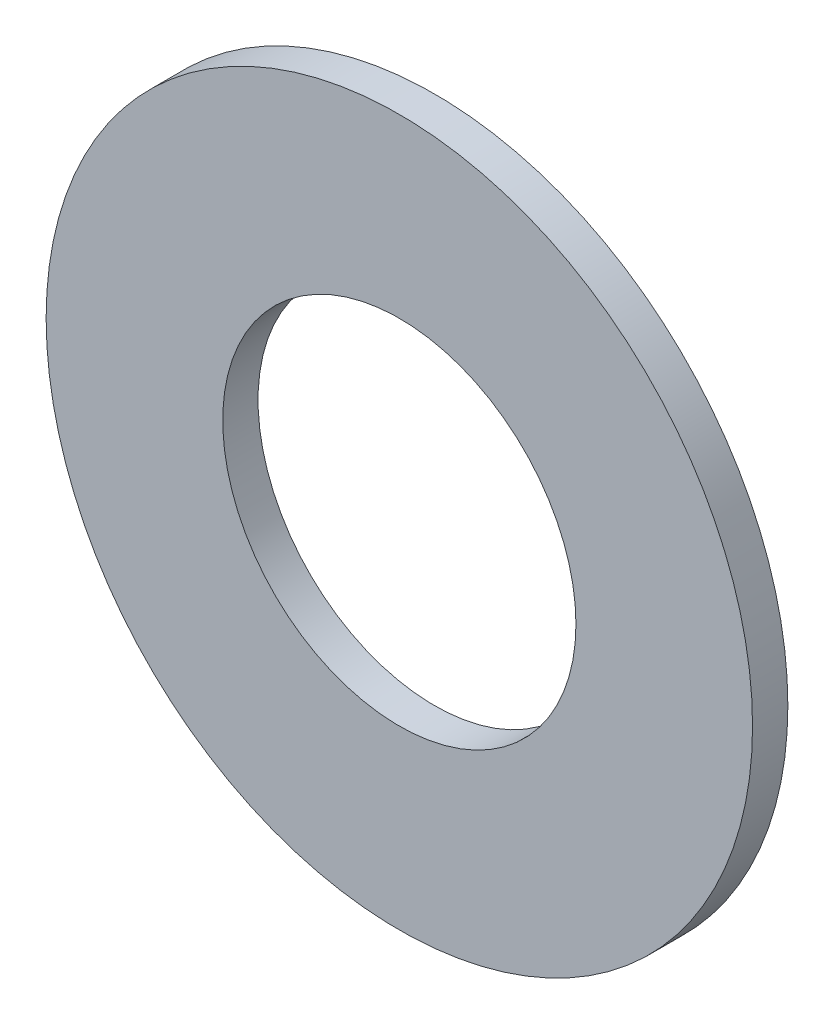
from build123d import *

# Parameters (mm, degrees)
SKETCH1_R           = 3
SKETCH1_R_2         = 1.5
BOSS_EXTRUDE1_DEPTH = 0.3


with BuildPart() as part:
    # Sketch1 → Boss-Extrude1 (new body)
    with BuildSketch(Plane.XY):
        Circle(SKETCH1_R)
        Circle(SKETCH1_R_2, mode=Mode.SUBTRACT)
    extrude(amount=BOSS_EXTRUDE1_DEPTH)


solid = part.part
